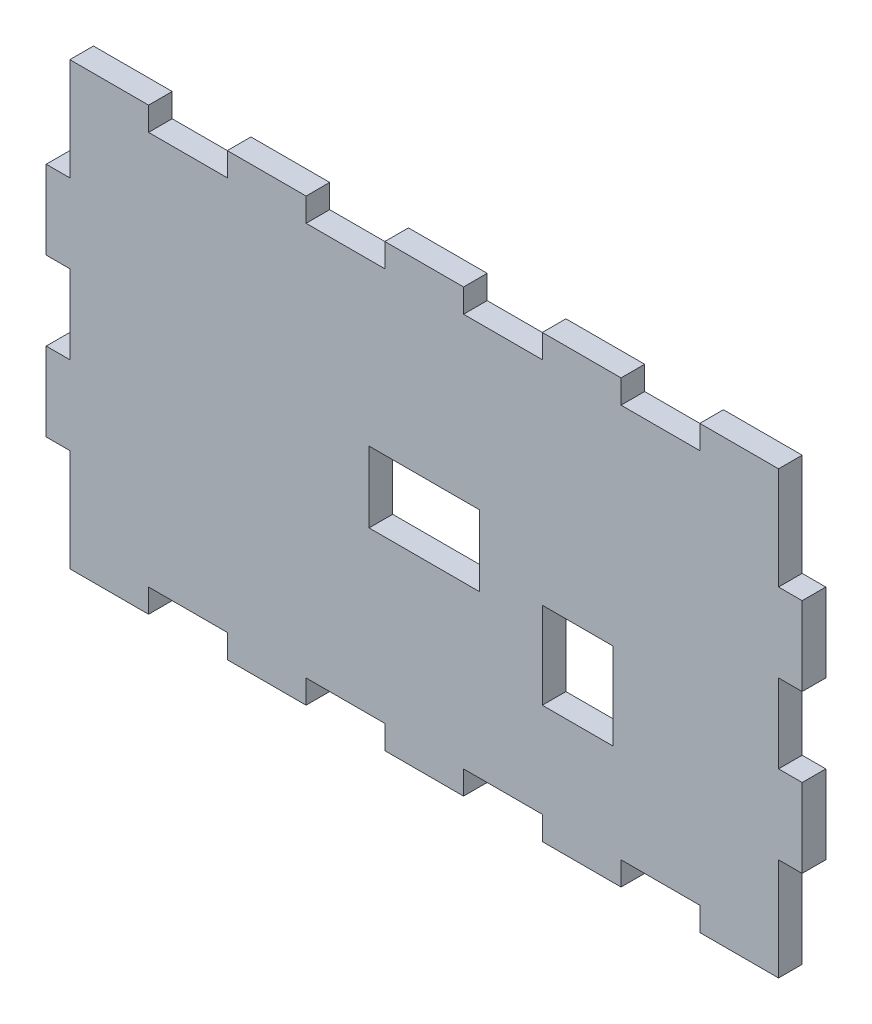
from build123d import *

# Parameters (mm, degrees)
BOSS_EXTRUDE1_DEPTH = 3
SKETCH2_W           = 9
SKETCH2_H           = 11
CUT_EXTRUDE1_DEPTH  = 3
SKETCH3_W           = 14
SKETCH3_H           = 9
CUT_EXTRUDE2_DEPTH  = 3


with BuildPart() as part:
    # Sketch1 → Boss-Extrude1 (new body)
    with BuildSketch(Plane.XY):
        Polygon((25, 28), (25, 25), (35, 25), (35, 28), (45, 28), (45, 25), (45, 15), (48, 15), (48, 5), (45, 5), (45, -5), (48, -5), (48, -15), (45, -15), (45, -25), (45, -28), (35, -28), (35, -25), (25, -25), (25, -28), (15, -28), (15, -25), (5, -25), (5, -28), (-5, -28), (-5, -25), (-15, -25), (-15, -28), (-25, -28), (-25, -25), (-35, -25), (-35, -28), (-45, -28), (-45, -25), (-45, -15), (-48, -15), (-48, -5), (-45, -5), (-45, 5), (-48, 5), (-48, 15), (-45, 15), (-45, 25), (-45, 28), (-35, 28), (-35, 25), (-25, 25), (-25, 28), (-15, 28), (-15, 25), (-5, 25), (-5, 28), (5, 28), (5, 25), (15, 25), (15, 28), align=None)
    extrude(amount=BOSS_EXTRUDE1_DEPTH)

    # Sketch2 → Cut-Extrude1 (cut)
    with BuildSketch(Plane.XY.offset(3)):
        with Locations((19.5, -7.5)):
            Rectangle(SKETCH2_W, SKETCH2_H)
    extrude(amount=-CUT_EXTRUDE1_DEPTH, mode=Mode.SUBTRACT)

    # Sketch3 → Cut-Extrude2 (cut)
    with BuildSketch(Plane.XY.offset(3)):
        Rectangle(SKETCH3_W, SKETCH3_H)
    extrude(amount=-CUT_EXTRUDE2_DEPTH, mode=Mode.SUBTRACT)


solid = part.part
